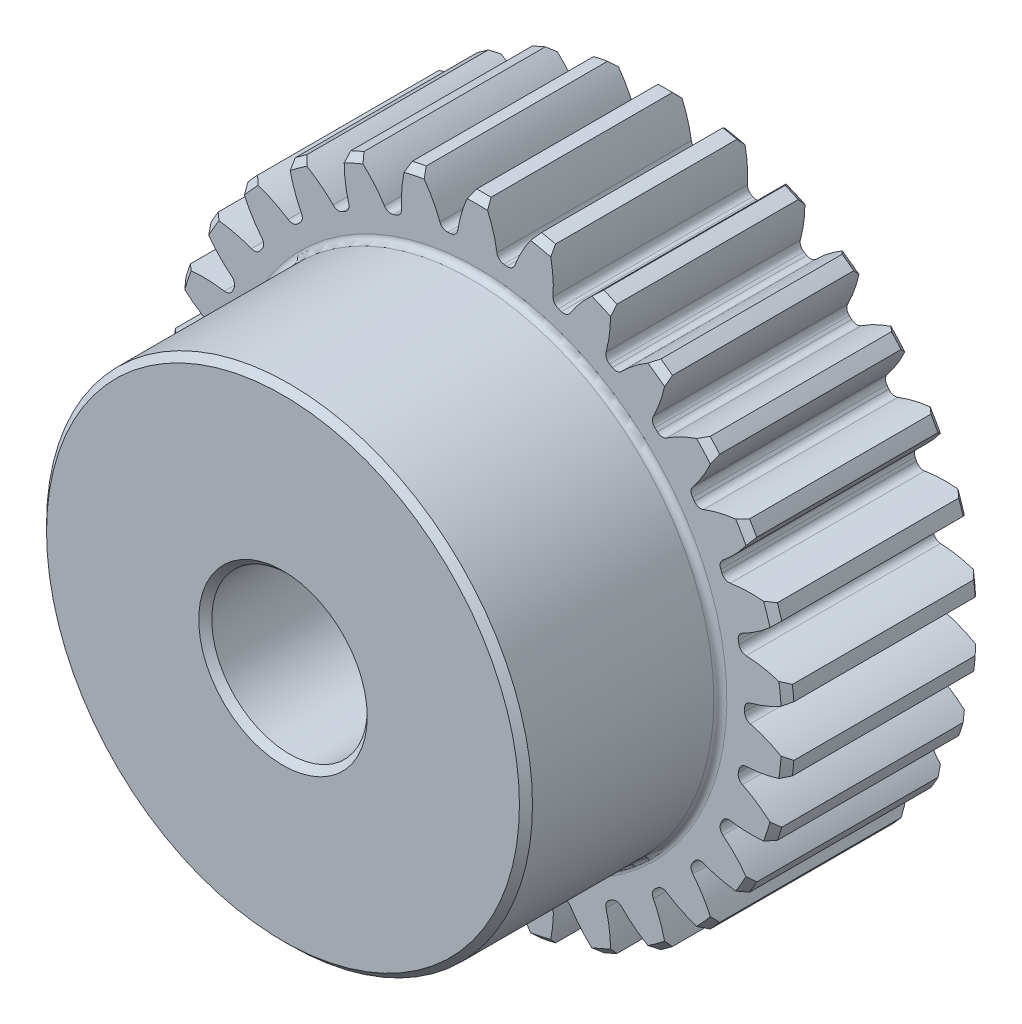
from build123d import *

# Parameters (mm, degrees)
BOSS_EXTRUDE1_DEPTH      = 10
BOSS_EXTRUDE1_DEPTH_BACK = 10
SKETCH3_R                = 16
SKETCH5_W                = 10
SKETCH5_H                = 3.5
SKETCH5_W_2              = 20
SKETCH5_H_2              = 4
FILLET2_R                = 0.335505036
CHAMFER1_SIZE            = 0.335505036
CUT_EXTRUDE1_DEPTH       = 25.738633754
FILLET1_R                = 0.392699082
CIRPATTERN1_COUNT        = 30
FILLET1_OF_CIRPATTERN1_R = 0.392699082


with BuildPart() as part:
    # Sketch3 → Boss-Extrude1 (new, two sides: drawn at the far end of the back side and taken through both)
    with BuildSketch(Plane.XY.offset(-BOSS_EXTRUDE1_DEPTH_BACK)):
        Circle(SKETCH3_R)
    extrude(amount=BOSS_EXTRUDE1_DEPTH + BOSS_EXTRUDE1_DEPTH_BACK)

    # Sketch5 → Cut-Revolve1 (revolve, cut)
    with BuildSketch(Plane(origin=(0, 0, 0), x_dir=(0, 0, -1), z_dir=(1, 0, 0)), mode=Mode.PRIVATE) as cut_revolve1_sk:
        with Locations((-5, 14.25)):
            Rectangle(SKETCH5_W, SKETCH5_H)
        with Locations((0, 2)):
            Rectangle(SKETCH5_W_2, SKETCH5_H_2)
    revolve(cut_revolve1_sk.sketch.rotate(Axis((0, 0, 10), (0, 0, -1)), 180), axis=Axis((0, 0, 10), (0, 0, -1)), mode=Mode.SUBTRACT)

    # Fillet2
    fillet2_edges = [part.edges().sort_by_distance(p)[0] for p in [
        (0, 12.5, 0),
    ]]
    fillet(fillet2_edges, radius=FILLET2_R)

    # Chamfer1
    chamfer1_edges = [part.edges().sort_by_distance(p)[0] for p in [
        (0, 4, 10),
        (0, 4, -10),
        (-16, 0, 0),
        (0, 12.5, 10),
        (-16, 0, -10),
    ]]
    chamfer(chamfer1_edges, length=CHAMFER1_SIZE)

    # Sketch4 → Cut-Extrude1 (cut, symmetric)
    with BuildSketch(Plane.XY):
        with BuildLine():
            Line((13.744391126, 0.392699082), (13.744391126, -0.392699082))
            ThreePointArc((13.744391126, -0.392699082), (14.887100169, -0.748713615), (15.946661901, -1.305363632))
            ThreePointArc((15.946661901, -1.305363632), (16, 0), (15.946661901, 1.305363632))
            ThreePointArc((15.946661901, 1.305363632), (14.887100169, 0.748713615), (13.744391126, 0.392699082))
        make_face()
    cut_extrude1 = extrude(amount=CUT_EXTRUDE1_DEPTH, both=True, mode=Mode.SUBTRACT)

    # Fillet1
    fillet1_edges = [part.edges().sort_by_distance(p)[0] for p in [
        (13.744391126, 0.392699082, -5),
        (13.744391126, -0.392699082, -5),
    ]]
    fillet(fillet1_edges, radius=FILLET1_R)

    # CirPattern1: Cut-Extrude1 ×30 about axis
    cirpattern1_axis = Axis((0, 0, 0), (0, 0, 1))
    for i in range(1, CIRPATTERN1_COUNT):
        add(cut_extrude1.rotate(cirpattern1_axis, i * 360 / CIRPATTERN1_COUNT), mode=Mode.SUBTRACT)

    # Fillet1 of CirPattern1
    fillet1_of_cirpattern1_edges = [part.edges().sort_by_distance(p)[0] for p in [
        (13.362396474, 3.241737263, -5),
        (13.525689934, 2.473501934, -5),
        (12.396400975, 5.94909597, -5),
        (12.715851188, 5.231599046, -5),
        (10.88862327, 8.396450637, -5),
        (11.350268727, 7.761050175, -5),
        (8.904960478, 10.476840119, -5),
        (9.488625059, 9.95130617, -5),
        (6.532108182, 12.099341416, -5),
        (7.212282944, 11.706642334, -5),
        (3.873771415, 13.193043433, -5),
        (4.620729456, 12.950342053, -5),
        (1.046132248, 13.710146145, -5),
        (1.827227918, 13.628049682, -5),
        (-1.827227918, 13.628049682, -5),
        (-1.046132248, 13.710146145, -5),
        (-4.620729456, 12.950342053, -5),
        (-3.873771415, 13.193043433, -5),
        (-7.212282944, 11.706642334, -5),
        (-6.532108182, 12.099341416, -5),
        (-9.488625059, 9.95130617, -5),
        (-8.904960478, 10.476840119, -5),
        (-11.350268727, 7.761050175, -5),
        (-10.88862327, 8.396450637, -5),
        (-12.715851188, 5.231599046, -5),
        (-12.396400975, 5.94909597, -5),
        (-13.525689934, 2.473501934, -5),
        (-13.362396474, 3.241737263, -5),
        (-13.744391126, -0.392699082, -5),
        (-13.744391126, 0.392699082, -5),
        (-13.362396474, -3.241737263, -5),
        (-13.525689934, -2.473501934, -5),
        (-12.396400975, -5.94909597, -5),
        (-12.715851188, -5.231599046, -5),
        (-10.88862327, -8.396450637, -5),
        (-11.350268727, -7.761050175, -5),
        (-8.904960478, -10.476840119, -5),
        (-9.488625059, -9.95130617, -5),
        (-6.532108182, -12.099341416, -5),
        (-7.212282944, -11.706642334, -5),
        (-3.873771415, -13.193043433, -5),
        (-4.620729456, -12.950342053, -5),
        (-1.046132248, -13.710146145, -5),
        (-1.827227918, -13.628049682, -5),
        (1.827227918, -13.628049682, -5),
        (1.046132248, -13.710146145, -5),
        (4.620729456, -12.950342053, -5),
        (3.873771415, -13.193043433, -5),
        (7.212282944, -11.706642334, -5),
        (6.532108182, -12.099341416, -5),
        (9.488625059, -9.95130617, -5),
        (8.904960478, -10.476840119, -5),
        (11.350268727, -7.761050175, -5),
        (10.88862327, -8.396450637, -5),
        (12.715851188, -5.231599046, -5),
        (12.396400975, -5.94909597, -5),
        (13.525689934, -2.473501934, -5),
        (13.362396474, -3.241737263, -5),
    ]]
    fillet(fillet1_of_cirpattern1_edges, radius=FILLET1_OF_CIRPATTERN1_R)


solid = part.part
